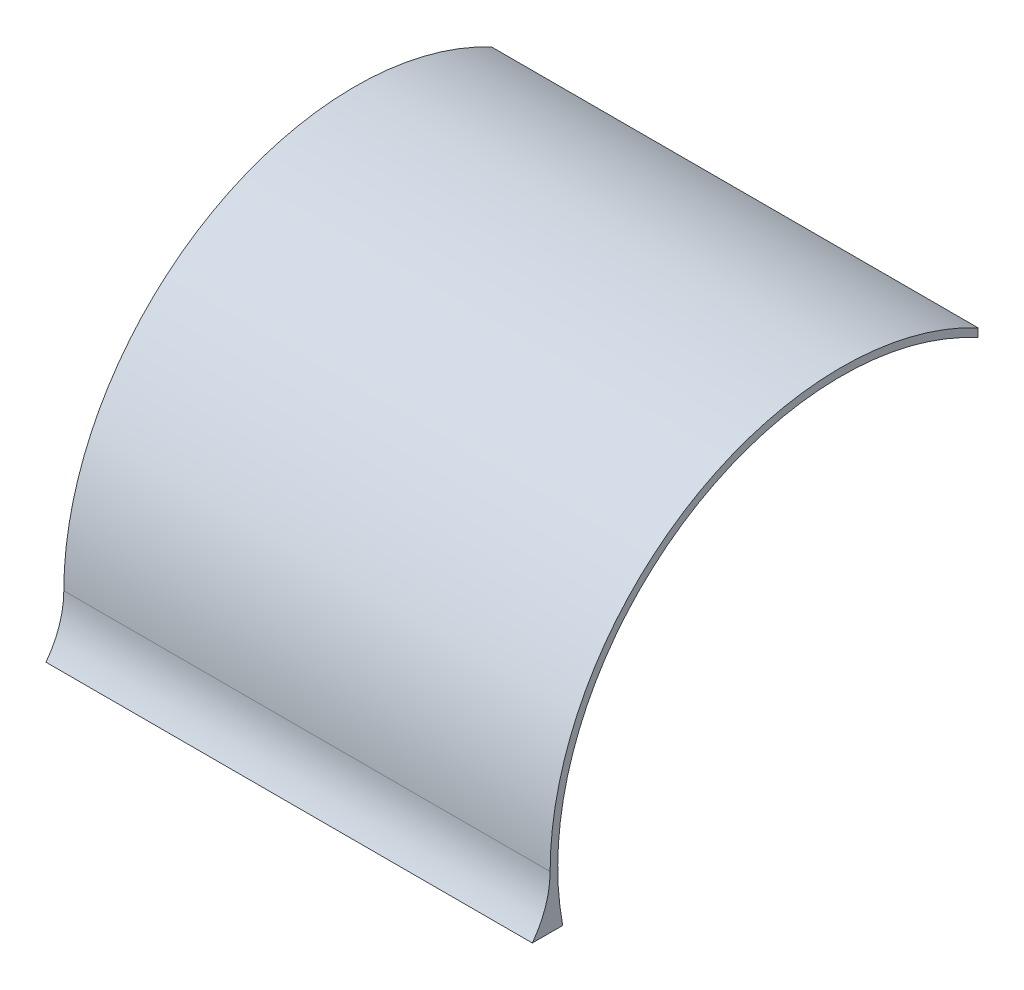
from build123d import *

# Parameters (mm, degrees)
SALIENTE_EXTRUIR1_DEPTH = 160
SALIENTE_EXTRUIR3_START = -160
SALIENTE_EXTRUIR3_DEPTH = 160


with BuildPart() as part:
    # Croquis1 → Saliente-Extruir1 (new body)
    with BuildSketch(Plane(origin=(0, 0, 0), x_dir=(0, 0, -1), z_dir=(1, 0, 0))):
        with BuildLine():
            ThreePointArc((45, 84.539297963), (-56.606836573, 77.249977043), (-94.168674728, -17.44))
            Line((-94.168674728, -17.44), (-91.624992769, -17.44))
            ThreePointArc((-91.624992769, -17.44), (-54.7766031, 75.490507038), (45, 81.696345696))
            Line((45, 81.696345696), (45, 84.539297963))
        make_face()
    extrude(amount=SALIENTE_EXTRUIR1_DEPTH)

    # Croquis2 → Saliente-Extruir3 (add)
    with BuildSketch(Plane(origin=(160, 0, 0), x_dir=(0, 0, -1), z_dir=(1, 0, 0)).offset(SALIENTE_EXTRUIR3_START)):
        with BuildLine():
            Line((-94.168674728, -17.44), (-101.624992769, -17.44))
            ThreePointArc((-101.624992769, -17.44), (-97.2728202, -9.198295227), (-95.77, 0))
            ThreePointArc((-95.77, 0), (-95.368828447, -8.756680916), (-94.168674728, -17.44))
        make_face()
    extrude(amount=SALIENTE_EXTRUIR3_DEPTH)


solid = part.part
